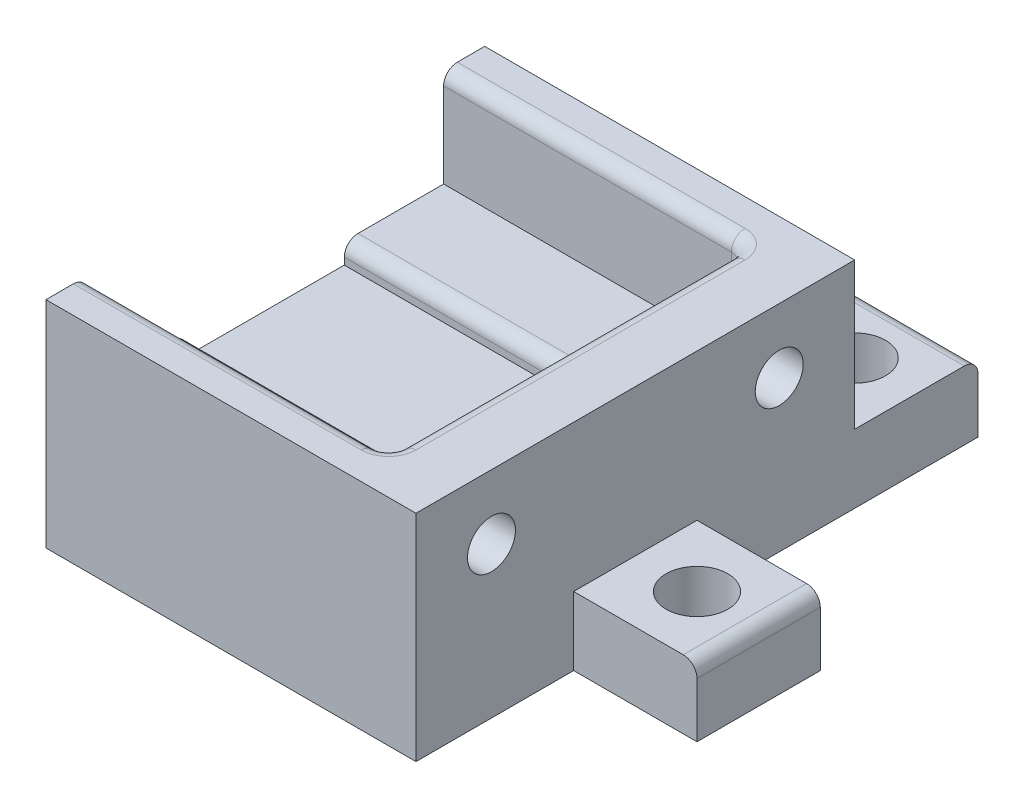
from build123d import *

# Parameters (mm, degrees)
BOSS_EXTRUDE1_DEPTH = 11
SKETCH3_W           = 22
SKETCH3_H           = 3
BOSS_EXTRUDE2_DEPTH = 15.7
BOSS_EXTRUDE3_DEPTH = 5
SKETCH5_R           = 1.75
CUT_EXTRUDE1_DEPTH  = 36.096650541
SKETCH6_W           = 9
SKETCH6_H           = 9
BOSS_EXTRUDE4_DEPTH = 5
SKETCH7_R           = 2.25
CUT_EXTRUDE2_DEPTH  = 37.945027801
FILLET1_R           = 1


with BuildPart() as part:
    # Sketch1 → Boss-Extrude1 (new, symmetric)
    with BuildSketch(Plane(origin=(0, 0, 0), x_dir=(0, 0, -1), z_dir=(1, 0, 0))):
        Polygon((-13.0089, 0), (13.0089, 0), (13.0089, 8.5), (5.7589, 8.5), (5.7589, 7), (-5.7589, 7), (-5.7589, 8.5), (-13.0089, 8.5), align=None)
    extrude(amount=BOSS_EXTRUDE1_DEPTH, both=True)

    # Sketch3 → Boss-Extrude2 (add)
    with BuildSketch(Plane.XZ):
        with Locations((0, -14.5089)):
            Rectangle(SKETCH3_W, SKETCH3_H)
        with Locations((0, 14.5089)):
            Rectangle(SKETCH3_W, SKETCH3_H)
    extrude(amount=-BOSS_EXTRUDE2_DEPTH)

    # Sketch4 → Boss-Extrude3 (add)
    with BuildSketch(Plane(origin=(11, 0, 0), x_dir=(0, 0, -1), z_dir=(1, 0, 0))):
        Polygon((-8.8, 15.7), (-16.0089, 15.7), (-16.0089, 0), (16.0089, 0), (16.0089, 15.7), align=None)
    extrude(amount=BOSS_EXTRUDE3_DEPTH)

    # Sketch5 → Cut-Extrude1 (cut, through all)
    with BuildSketch(Plane(origin=(16, 0, 0), x_dir=(0, 0, -1), z_dir=(1, 0, 0))):
        with Locations((-10.5, 11)):
            Circle(SKETCH5_R)
        with Locations((10.5, 11)):
            Circle(SKETCH5_R)
    extrude(amount=-CUT_EXTRUDE1_DEPTH, mode=Mode.SUBTRACT)

    # Sketch6 → Boss-Extrude4 (add)
    with BuildSketch(Plane.XZ):
        with Locations((20.5, 0)):
            Rectangle(SKETCH6_W, SKETCH6_H)
        with Locations((11.5, -20.5089)):
            Rectangle(SKETCH6_W, SKETCH6_H)
    extrude(amount=-BOSS_EXTRUDE4_DEPTH)

    # Sketch7 → Cut-Extrude2 (cut, through all)
    with BuildSketch(Plane(origin=(0, 5, 0), x_dir=(1, 0, 0), z_dir=(0, 1, 0))):
        with Locations(Location((20.5, 0, 0), (0, 0, 270))):
            Circle(SKETCH7_R)
        with Locations(Location((11.5, 20.5089, 0), (0, 0, 270))):
            Circle(SKETCH7_R)
    extrude(amount=-CUT_EXTRUDE2_DEPTH, mode=Mode.SUBTRACT)

    # Fillet1
    fillet1_edges = [part.edges().sort_by_distance(p)[0] for p in [
        (0, 8.5, 5.7589),
        (0, 8.5, -5.7589),
        (0, 15.7, -13.0089),
        (11, 12.1, -13.0089),
        (11, 12.1, 13.0089),
        (0, 15.7, 13.0089),
        (11, 15.7, 0),
        (25, 5, 0),
        (11.5, 5, -25.0089),
    ]]
    fillet(fillet1_edges, radius=FILLET1_R)


solid = part.part
